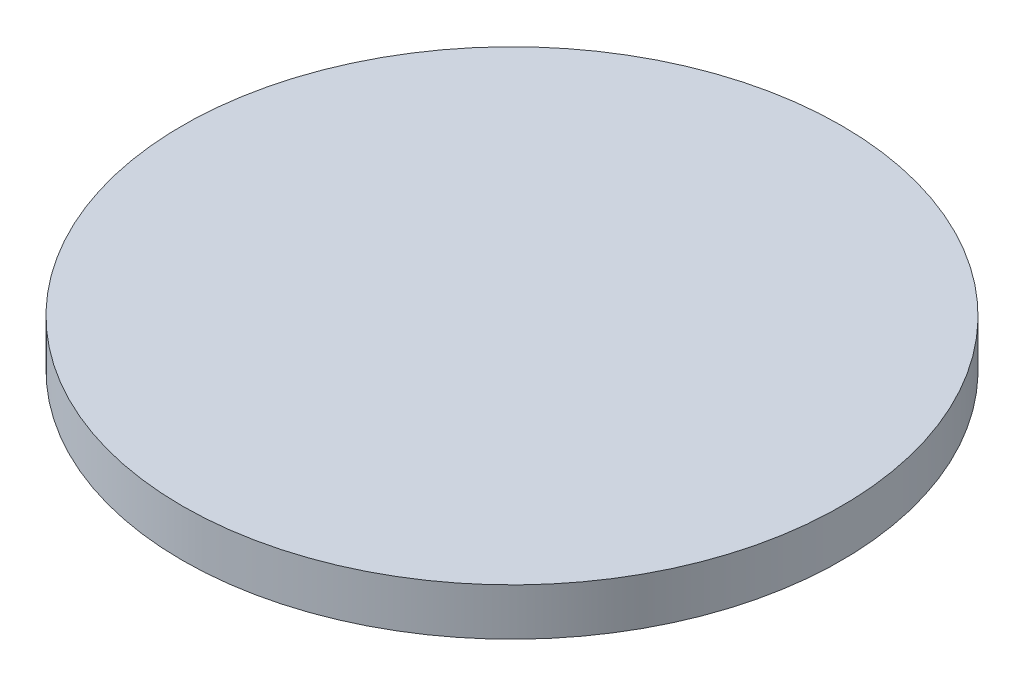
from build123d import *

# Parameters (mm, degrees)
IZIM1_R                     = 28
Y_KSEKLIK_EKSTR_ZYON1_DEPTH = 4


with BuildPart() as part:
    # Çizim1 → Yükseklik-Ekstrüzyon1 (new body)
    with BuildSketch(Plane(origin=(0, 0, 0), x_dir=(1, 0, 0), z_dir=(0, 1, 0))):
        with Locations(Location((0, 0, 0), (0, 0, 270))):
            Circle(IZIM1_R)
    extrude(amount=Y_KSEKLIK_EKSTR_ZYON1_DEPTH)


solid = part.part
